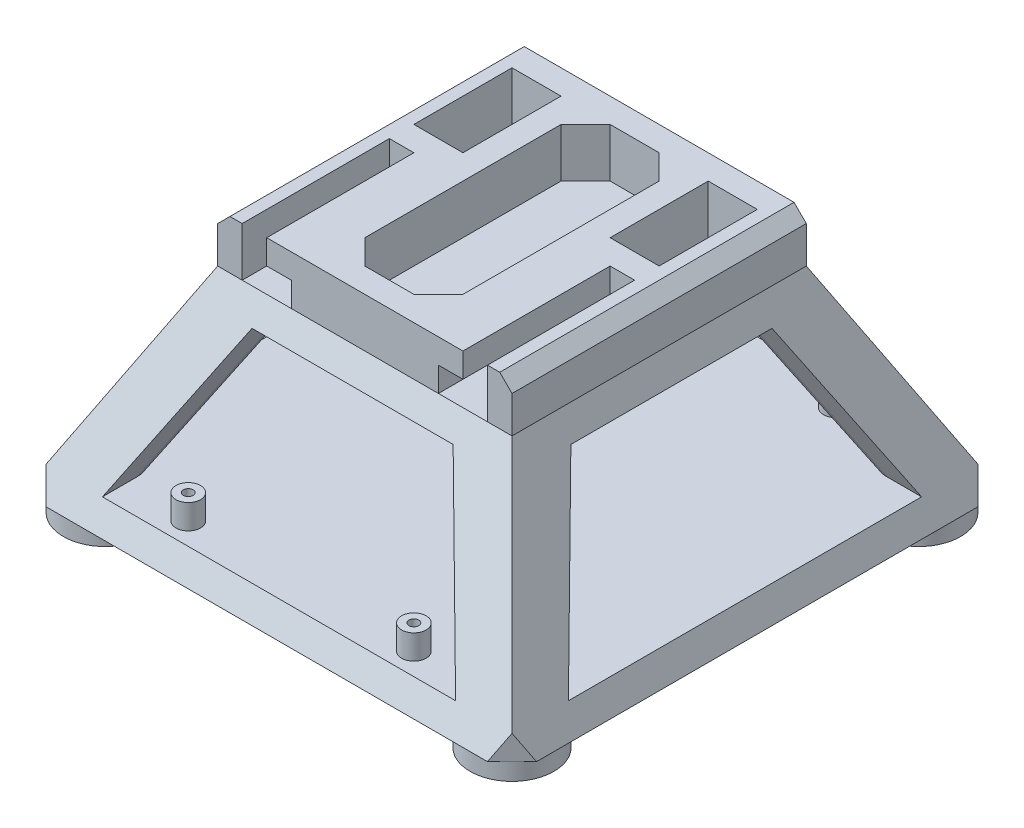
from build123d import *

# Parameters (mm, degrees)
EXTRUDE_1_DEPTH      = 30
EXTRUDE_1_DEPTH_BACK = 30
SKETCH_7_W           = 5
SKETCH_7_H           = 10
CUT_EXTRUDE_1_DEPTH  = 87.602540494
CUT_EXTRUDE_START    = -30
CUT_EXTRUDE_3_DEPTH  = 60
SKETCH_12_W          = 10
SKETCH_12_H          = 10
EXTRUDE_3_DEPTH      = 5
EXTRUDE_START        = -30
SKETCH_13_W          = 10
SKETCH_13_H          = 10
EXTRUDE_4_DEPTH      = 5
EXTRUDE_START_2      = 30
SKETCH_14_W          = 20
SKETCH_14_H          = 10
EXTRUDE_5_DEPTH      = 5
CUT_EXTRUDE_START_2  = 50
SKETCH_15_W          = 5
SKETCH_15_H          = 20
CUT_EXTRUDE_4_DEPTH  = 5
SKETCH_16_W          = 20
SKETCH_16_H          = 10
EXTRUDE_6_DEPTH      = 5
EXTRUDE_START_3      = 40
EXTRUDE_7_DEPTH      = 10
CUT_EXTRUDE_START_3  = 5
SKETCH_21_R          = 1
CUT_EXTRUDE_5_DEPTH  = 5
EXTRUDE_START_4      = 10
SKETCH_22_R          = 2.5
SKETCH_22_R_2        = 1
EXTRUDE_8_DEPTH      = 5
SKETCH_23_R          = 1.75
CUT_EXTRUDE_6_DEPTH  = 2
EXTRUDE_9_DEPTH      = 3.5
EXTRUDE_START_5      = -1.5
EXTRUDE_10_DEPTH     = 2
FILLET_1_R           = 5


with BuildPart() as part:
    # 草图1 → 放样1 section 0
    with BuildSketch(Plane(origin=(0, 0, 0), x_dir=(1, 0, 0), z_dir=(0, 1, 0))):
        with BuildLine():
            Line((-50, 50), (50, 50))
            Line((50, 50), (50, -50))
            Line((50, -50), (-50, -50))
            Line((-50, -50), (-50, 50))
        make_face()
    # 草图2 → 放样1 section 1
    with BuildSketch(Plane(origin=(0, 40, 0), x_dir=(1, 0, 0), z_dir=(0, 1, 0))):
        with BuildLine():
            Line((-30, 30), (30, 30))
            Line((30, 30), (30, -30))
            Line((30, -30), (-30, -30))
            Line((-30, -30), (-30, 30))
        make_face()
    loft()

    # 草图4 → 切除-放样2 section 0
    with BuildSketch(Plane(origin=(0, 5, 0), x_dir=(1, 0, 0), z_dir=(0, 1, 0))):
        with BuildLine():
            Line((-36, -48), (36, -48))
            Line((36, -48), (36, -36))
            Line((36, -36), (48, -36))
            Line((48, -36), (48, 36))
            Line((48, 36), (36, 36))
            Line((36, 36), (36, 48))
            Line((36, 48), (-36, 48))
            Line((-36, 48), (-36, 36))
            Line((-36, 36), (-48, 36))
            Line((-48, 36), (-48, -36))
            Line((-48, -36), (-36, -36))
            Line((-36, -36), (-36, -48))
        make_face()
    # 草图6 → 切除-放样2 section 1
    with BuildSketch(Plane(origin=(0, 35, 0), x_dir=(1, 0, 0), z_dir=(0, 1, 0))):
        with BuildLine():
            Line((-32.5, 20.5), (-32.5, -20.5))
            Line((-32.5, -20.5), (-20.5, -20.5))
            Line((-20.5, -20.5), (-20.5, -32.5))
            Line((-20.5, -32.5), (20.5, -32.5))
            Line((20.5, -32.5), (20.5, -20.5))
            Line((20.5, -20.5), (32.5, -20.5))
            Line((32.5, -20.5), (32.5, 20.5))
            Line((32.5, 20.5), (20.5, 20.5))
            Line((20.5, 20.5), (20.5, 32.5))
            Line((20.5, 32.5), (-20.5, 32.5))
            Line((-20.5, 32.5), (-20.5, 20.5))
            Line((-20.5, 20.5), (-32.5, 20.5))
        make_face()
    loft(mode=Mode.SUBTRACT)

    # 草图7 → 凸台-拉伸1 (add, two sides: drawn at the far end of the back side and taken through both)
    with BuildSketch(Plane.XY.offset(-EXTRUDE_1_DEPTH_BACK)):
        Polygon((-10, 40), (-10, 50), (-20, 50), (-20, 45), (-15, 45), (-15, 40), align=None)
        with Locations((-27.5, 45)):
            Rectangle(SKETCH_7_W, SKETCH_7_H)
        with Locations((27.5, 45)):
            Rectangle(SKETCH_7_W, SKETCH_7_H)
        Polygon((15, 40), (10, 40), (10, 50), (20, 50), (20, 45), (15, 45), align=None)
    extrude(amount=EXTRUDE_1_DEPTH + EXTRUDE_1_DEPTH_BACK)

    # 草图8 → 切除-拉伸1 (cut, through all)
    with BuildSketch(Plane(origin=(0, 0, 0), x_dir=(1, 0, 0), z_dir=(0, 1, 0))):
        Polygon((-50, 50), (-45, 50), (-50, 45), align=None)
        Polygon((45, 50), (50, 50), (50, 45), align=None)
        Polygon((-50, -50), (-45, -50), (-50, -45), align=None)
        Polygon((50, -50), (50, -45), (45, -50), align=None)
    extrude(amount=CUT_EXTRUDE_1_DEPTH, mode=Mode.SUBTRACT)

    # 草图10 → 切除-拉伸3 (cut)
    with BuildSketch(Plane.XY.offset(CUT_EXTRUDE_START)):
        Polygon((-30, 50), (-27.5, 50), (-30, 47.5), align=None)
        Polygon((30, 47.5), (30, 50), (27.5, 50), align=None)
    extrude(amount=CUT_EXTRUDE_3_DEPTH, mode=Mode.SUBTRACT)

    # 草图12 → 凸台-拉伸3 (add)
    with BuildSketch(Plane.XY):
        with Locations((-20, 45)):
            Rectangle(SKETCH_12_W, SKETCH_12_H)
        with Locations((20, 45)):
            Rectangle(SKETCH_12_W, SKETCH_12_H)
    extrude(amount=-EXTRUDE_3_DEPTH)

    # 草图13 → 凸台-拉伸4 (add)
    with BuildSketch(Plane.XY.offset(EXTRUDE_START)):
        with Locations((20, 45)):
            Rectangle(SKETCH_13_W, SKETCH_13_H)
        with Locations((-20, 45)):
            Rectangle(SKETCH_13_W, SKETCH_13_H)
    extrude(amount=EXTRUDE_4_DEPTH)

    # 草图14 → 凸台-拉伸5 (add)
    with BuildSketch(Plane.XY.offset(EXTRUDE_START_2)):
        with Locations((0, 45)):
            Rectangle(SKETCH_14_W, SKETCH_14_H)
    extrude(amount=-EXTRUDE_5_DEPTH)

    # 草图15 → 切除-拉伸4 (cut)
    with BuildSketch(Plane(origin=(0, 0, 0), x_dir=(1, 0, 0), z_dir=(0, 1, 0)).offset(CUT_EXTRUDE_START_2)):
        with Locations((17.5, 15)):
            Rectangle(SKETCH_15_W, SKETCH_15_H)
        with Locations((-17.5, 15)):
            Rectangle(SKETCH_15_W, SKETCH_15_H)
    extrude(amount=-CUT_EXTRUDE_4_DEPTH, mode=Mode.SUBTRACT)

    # 草图16 → 凸台-拉伸6 (add)
    with BuildSketch(Plane.XY.offset(EXTRUDE_START)):
        with Locations((0, 45)):
            Rectangle(SKETCH_16_W, SKETCH_16_H)
    extrude(amount=EXTRUDE_6_DEPTH)

    # 草图18 → 凸台-拉伸7 (add)
    with BuildSketch(Plane(origin=(0, 0, 0), x_dir=(1, 0, 0), z_dir=(0, 1, 0)).offset(EXTRUDE_START_3)):
        Polygon((5, 25), (10, 25), (10, 20), align=None)
        Polygon((-10, 25), (-5, 25), (-10, 20), align=None)
        Polygon((-10, -25), (-5, -25), (-10, -20), align=None)
        Polygon((5, -25), (10, -25), (10, -20), align=None)
    extrude(amount=EXTRUDE_7_DEPTH)

    # 草图21 → 切除-拉伸5 (cut)
    with BuildSketch(Plane(origin=(0, 0, 0), x_dir=(1, 0, 0), z_dir=(0, 1, 0)).offset(CUT_EXTRUDE_START_3)):
        with Locations(Location((-23, 43, 0), (0, 0, 270))):
            Circle(SKETCH_21_R)
        with Locations(Location((23, 43, 0), (0, 0, 270))):
            Circle(SKETCH_21_R)
        with Locations(Location((-23, -43, 0), (0, 0, 270))):
            Circle(SKETCH_21_R)
        with Locations(Location((23, -43, 0), (0, 0, 270))):
            Circle(SKETCH_21_R)
    extrude(amount=-CUT_EXTRUDE_5_DEPTH, mode=Mode.SUBTRACT)

    # 草图22 → 凸台-拉伸8 (add)
    # profile 1 of 4: a face of its own
    with BuildSketch(Plane(origin=(0, 0, 0), x_dir=(1, 0, 0), z_dir=(0, 1, 0)).offset(EXTRUDE_START_4)):
        with Locations(Location((-23, 43, 0), (0, 0, 270))):
            Circle(SKETCH_22_R)
        with Locations(Location((-23, 43, 0), (0, 0, 270))):
            Circle(SKETCH_22_R_2, mode=Mode.SUBTRACT)
    # profile 2 of 4: a face of its own
    with BuildSketch(Plane(origin=(0, 0, 0), x_dir=(1, 0, 0), z_dir=(0, 1, 0)).offset(EXTRUDE_START_4)):
        with Locations(Location((23, 43, 0), (0, 0, 270))):
            Circle(SKETCH_22_R)
        with Locations(Location((23, 43, 0), (0, 0, 270))):
            Circle(SKETCH_22_R_2, mode=Mode.SUBTRACT)
    # profile 3 of 4: a face of its own
    with BuildSketch(Plane(origin=(0, 0, 0), x_dir=(1, 0, 0), z_dir=(0, 1, 0)).offset(EXTRUDE_START_4)):
        with Locations(Location((-23, -43, 0), (0, 0, 270))):
            Circle(SKETCH_22_R)
        with Locations(Location((-23, -43, 0), (0, 0, 270))):
            Circle(SKETCH_22_R_2, mode=Mode.SUBTRACT)
    # profile 4 of 4: a face of its own
    with BuildSketch(Plane(origin=(0, 0, 0), x_dir=(1, 0, 0), z_dir=(0, 1, 0)).offset(EXTRUDE_START_4)):
        with Locations(Location((23, -43, 0), (0, 0, 270))):
            Circle(SKETCH_22_R)
        with Locations(Location((23, -43, 0), (0, 0, 270))):
            Circle(SKETCH_22_R_2, mode=Mode.SUBTRACT)
    extrude(amount=-EXTRUDE_8_DEPTH)

    # 草图23 → 切除-拉伸6 (cut)
    with BuildSketch(Plane(origin=(0, 0, 0), x_dir=(1, 0, 0), z_dir=(0, 1, 0))):
        with Locations(Location((-23, -43, 0), (0, 0, 270))):
            Circle(SKETCH_23_R)
        with Locations(Location((23, -43, 0), (0, 0, 270))):
            Circle(SKETCH_23_R)
        with Locations(Location((-23, 43, 0), (0, 0, 270))):
            Circle(SKETCH_23_R)
        with Locations(Location((23, 43, 0), (0, 0, 270))):
            Circle(SKETCH_23_R)
    extrude(amount=CUT_EXTRUDE_6_DEPTH, mode=Mode.SUBTRACT)

    # 草图24 → 凸台-拉伸9 (add)
    with BuildSketch(Plane(origin=(0, 0, 0), x_dir=(1, 0, 0), z_dir=(0, 1, 0))):
        with BuildLine():
            Line((-39.166369055, 43.762563133), (-33.58547132, 38.181665398))
            ThreePointArc((-33.58547132, 38.181665398), (-47.5, 47.5), (-38.181665398, 33.58547132))
            Line((-38.181665398, 33.58547132), (-43.762563133, 39.166369055))
            ThreePointArc((-43.762563133, 39.166369055), (-43.762563133, 43.762563133), (-39.166369055, 43.762563133))
        make_face()
        with BuildLine():
            Line((-38.181665398, -33.58547132), (-43.762563133, -39.166369055))
            ThreePointArc((-43.762563133, -39.166369055), (-43.762563133, -43.762563133), (-39.166369055, -43.762563133))
            Line((-39.166369055, -43.762563133), (-33.58547132, -38.181665398))
            ThreePointArc((-33.58547132, -38.181665398), (-47.5, -47.5), (-38.181665398, -33.58547132))
        make_face()
        with BuildLine():
            Line((38.181665398, -33.58547132), (43.762563133, -39.166369055))
            ThreePointArc((43.762563133, -39.166369055), (43.762563133, -43.762563133), (39.166369055, -43.762563133))
            Line((39.166369055, -43.762563133), (33.58547132, -38.181665398))
            ThreePointArc((33.58547132, -38.181665398), (47.5, -47.5), (38.181665398, -33.58547132))
        make_face()
        with BuildLine():
            Line((43.762563133, 39.166369055), (38.181665398, 33.58547132))
            ThreePointArc((38.181665398, 33.58547132), (47.5, 47.5), (33.58547132, 38.181665398))
            Line((33.58547132, 38.181665398), (39.166369055, 43.762563133))
            ThreePointArc((39.166369055, 43.762563133), (43.762563133, 43.762563133), (43.762563133, 39.166369055))
        make_face()
    extrude(amount=-EXTRUDE_9_DEPTH)

    # 草图25 → 凸台-拉伸10 (add)
    with BuildSketch(Plane(origin=(0, 0, 0), x_dir=(1, 0, 0), z_dir=(0, 1, 0)).offset(EXTRUDE_START_5)):
        with BuildLine():
            Line((-42.525126266, -40.403805922), (-36.583521303, -34.46220096))
            ThreePointArc((-36.583521303, -34.46220096), (-47.5, -47.5), (-34.46220096, -36.583521303))
            Line((-34.46220096, -36.583521303), (-40.403805922, -42.525126266))
            ThreePointArc((-40.403805922, -42.525126266), (-42.525126266, -42.525126266), (-42.525126266, -40.403805922))
        make_face()
        with BuildLine():
            Line((40.403805922, -42.525126266), (34.46220096, -36.583521303))
            ThreePointArc((34.46220096, -36.583521303), (47.5, -47.5), (36.583521303, -34.46220096))
            Line((36.583521303, -34.46220096), (42.525126266, -40.403805922))
            ThreePointArc((42.525126266, -40.403805922), (42.525126266, -42.525126266), (40.403805922, -42.525126266))
        make_face()
        with BuildLine():
            Line((42.525126266, 40.403805922), (36.583521303, 34.46220096))
            ThreePointArc((36.583521303, 34.46220096), (47.5, 47.5), (34.46220096, 36.583521303))
            Line((34.46220096, 36.583521303), (40.403805922, 42.525126266))
            ThreePointArc((40.403805922, 42.525126266), (42.525126266, 42.525126266), (42.525126266, 40.403805922))
        make_face()
        with BuildLine():
            Line((-40.403805922, 42.525126266), (-34.46220096, 36.583521303))
            ThreePointArc((-34.46220096, 36.583521303), (-47.5, 47.5), (-36.583521303, 34.46220096))
            Line((-36.583521303, 34.46220096), (-42.525126266, 40.403805922))
            ThreePointArc((-42.525126266, 40.403805922), (-42.525126266, 42.525126266), (-40.403805922, 42.525126266))
        make_face()
    extrude(amount=-EXTRUDE_10_DEPTH)

    # 圆角1
    fillet_1_edges = [part.edges().sort_by_distance(p)[0] for p in [
        (-28.25, 20, -28.25),
        (28.25, 20, -28.25),
        (28.25, 20, 28.25),
        (-28.25, 20, 28.25),
    ]]
    fillet(fillet_1_edges, radius=FILLET_1_R)


solid = part.part
